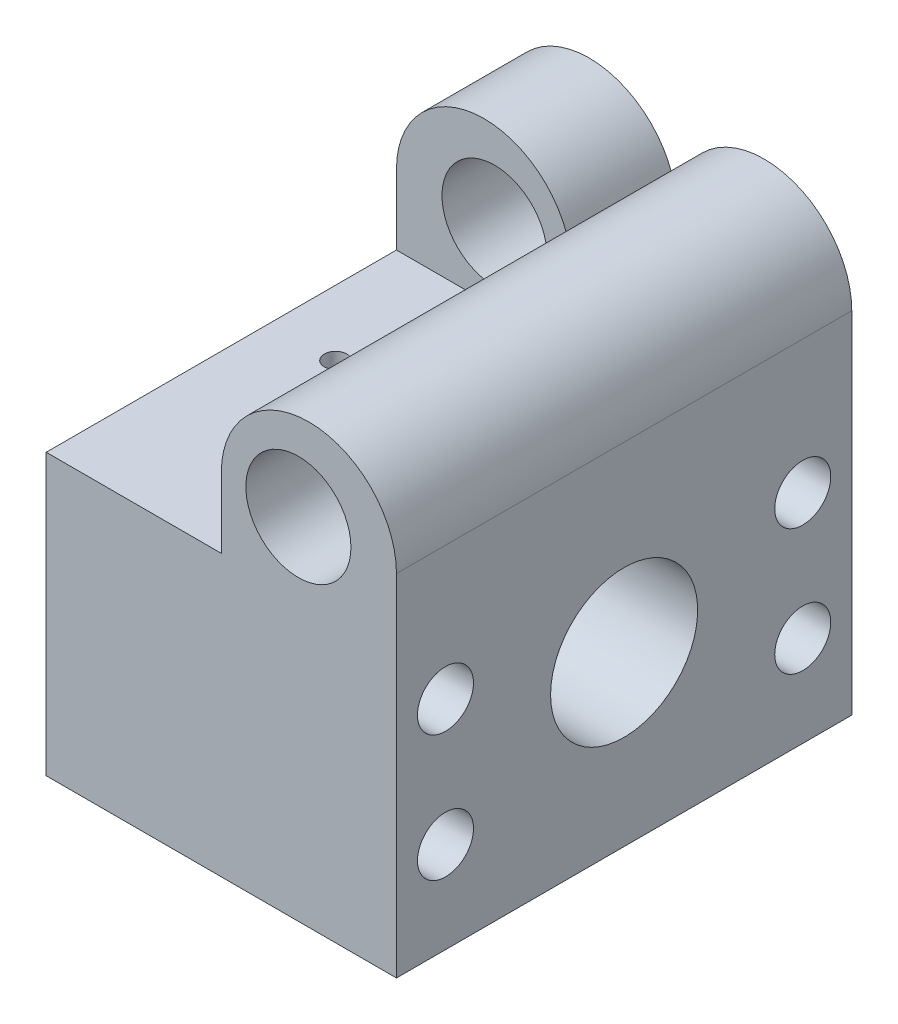
from build123d import *

# Parameters (mm, degrees)
SKETCH1_R               = 7.5
BOSS_EXTRUDE1_DEPTH     = 15
SKETCH2_R               = 7.5
BOSS_EXTRUDE2_DEPTH     = 50
SKETCH3_W               = 50
SKETCH3_H               = 40
BOSS_EXTRUDE3_DEPTH     = 65
CUT_EXTRUDE2_DEPTH      = 96.372952141
SKETCH9_R               = 4
SKETCH9_R_2             = 10.5
CUT_EXTRUDE3_DEPTH      = 104.107953137
CUT_EXTRUDE4_DEPTH      = 92.241437954
CUT_EXTRUDE4_DEPTH_BACK = 92.241437954
SKETCH10_R              = 1.6


with BuildPart() as part:
    # Sketch1 → Boss-Extrude1 (new body)
    with BuildSketch(Plane.XY):
        with BuildLine():
            Line((0, 0), (50, 0))
            Line((50, 0), (50, 50))
            ThreePointArc((50, 50), (40.582575695, 63.228756555), (25, 58.660254038))
            ThreePointArc((25, 58.660254038), (9.417424305, 63.228756555), (0, 50))
            Line((0, 50), (0, 0))
        make_face()
        with Locations((36, 50)):
            Circle(SKETCH1_R, mode=Mode.SUBTRACT)
        with Locations((14, 50)):
            Circle(SKETCH1_R, mode=Mode.SUBTRACT)
    extrude(amount=BOSS_EXTRUDE1_DEPTH)

    # Sketch2 → Boss-Extrude2 (add)
    with BuildSketch(Plane.XY.offset(15)):
        with BuildLine():
            Line((25, 50), (25, 0))
            Line((25, 0), (50, 0))
            Line((50, 0), (50, 50))
            ThreePointArc((50, 50), (37.5, 62.5), (25, 50))
        make_face()
        with Locations((36, 50)):
            Circle(SKETCH2_R, mode=Mode.SUBTRACT)
    extrude(amount=BOSS_EXTRUDE2_DEPTH)

    # Sketch3 → Boss-Extrude3 (add)
    with BuildSketch(Plane(origin=(0, 0, 0), x_dir=(-1, 0, 0), z_dir=(0, 0, -1))):
        with Locations((-25, 20)):
            Rectangle(SKETCH3_W, SKETCH3_H)
    extrude(amount=-BOSS_EXTRUDE3_DEPTH)

    # Sketch2<3> → Cut-Extrude2 (cut, through all)
    with BuildSketch(Plane.XY.offset(15)):
        with BuildLine():
            ThreePointArc((25, 58.660254038), (9.417424305, 63.228756555), (0, 50))
            ThreePointArc((0, 50), (12.5, 62.5), (25, 50))
            ThreePointArc((25, 50), (37.5, 62.5), (50, 50))
            ThreePointArc((50, 50), (40.582575695, 63.228756555), (25, 58.660254038))
        make_face()
    extrude(amount=-CUT_EXTRUDE2_DEPTH, mode=Mode.SUBTRACT)

    # Sketch9 → Cut-Extrude3 (cut, through all)
    with BuildSketch(Plane.ZY):
        with Locations((7, 13)):
            Circle(SKETCH9_R)
        with Locations((58, 13)):
            Circle(SKETCH9_R)
        with Locations((58, 31)):
            Circle(SKETCH9_R)
        with Locations((7, 31)):
            Circle(SKETCH9_R)
        with Locations((32.5, 24)):
            Circle(SKETCH9_R_2)
    extrude(amount=-CUT_EXTRUDE3_DEPTH, mode=Mode.SUBTRACT)

    # Sketch10 → Cut-Extrude4 (cut, two sides: drawn at the far end of the back side and taken through both)
    with BuildSketch(Plane(origin=(0, 40, 0), x_dir=(1, 0, 0), z_dir=(0, 1, 0)).offset(-CUT_EXTRUDE4_DEPTH_BACK)):
        with Locations((9.306144925, -33)):
            Circle(SKETCH10_R)
    extrude(amount=CUT_EXTRUDE4_DEPTH + CUT_EXTRUDE4_DEPTH_BACK, mode=Mode.SUBTRACT)


solid = part.part
